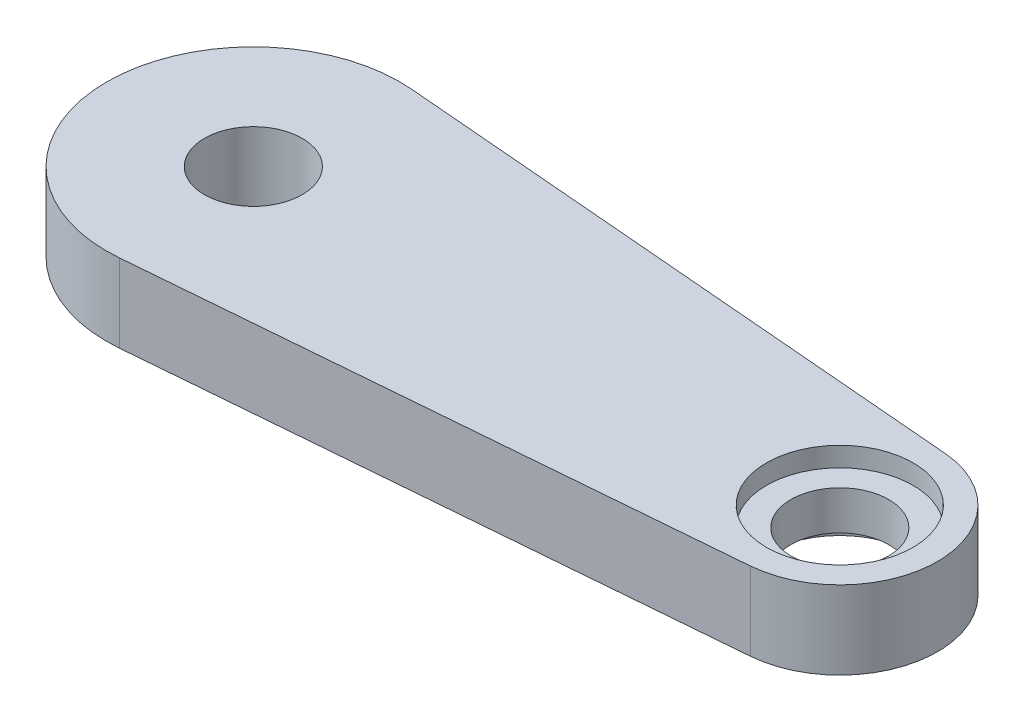
from build123d import *

# Parameters (mm, degrees)
SKETCH1_R           = 12.5
SKETCH1_R_2         = 18.75
BOSS_EXTRUDE1_DEPTH = 10
SKETCH1_3_R         = 18.75
SKETCH1_3_R_2       = 12.5
BOSS_EXTRUDE2_DEPTH = 5


with BuildPart() as part:
    # Sketch1 → Boss-Extrude1 (new, symmetric)
    with BuildSketch(Plane(origin=(0, 0, 0), x_dir=(1, 0, 0), z_dir=(0, 1, 0))):
        with BuildLine():
            Line((77.083333333, 24.913043215), (-71.875, 37.369564822))
            ThreePointArc((-71.875, 37.369564822), (-112.5, 0), (-71.875, -37.369564822))
            Line((-71.875, -37.369564822), (77.083333333, -24.913043215))
            ThreePointArc((77.083333333, -24.913043215), (100, 0), (77.083333333, 24.913043215))
        make_face()
        with Locations((-75, 0)):
            Circle(SKETCH1_R, mode=Mode.SUBTRACT)
        with Locations((75, 0)):
            Circle(SKETCH1_R_2, mode=Mode.SUBTRACT)
    extrude(amount=BOSS_EXTRUDE1_DEPTH, both=True)

    # Sketch1<3> → Boss-Extrude2 (add, symmetric)
    with BuildSketch(Plane(origin=(0, 0, 0), x_dir=(1, 0, 0), z_dir=(0, 1, 0))):
        with Locations((75, 0)):
            Circle(SKETCH1_3_R)
        with Locations((75, 0)):
            Circle(SKETCH1_3_R_2, mode=Mode.SUBTRACT)
    extrude(amount=BOSS_EXTRUDE2_DEPTH, both=True)


solid = part.part
